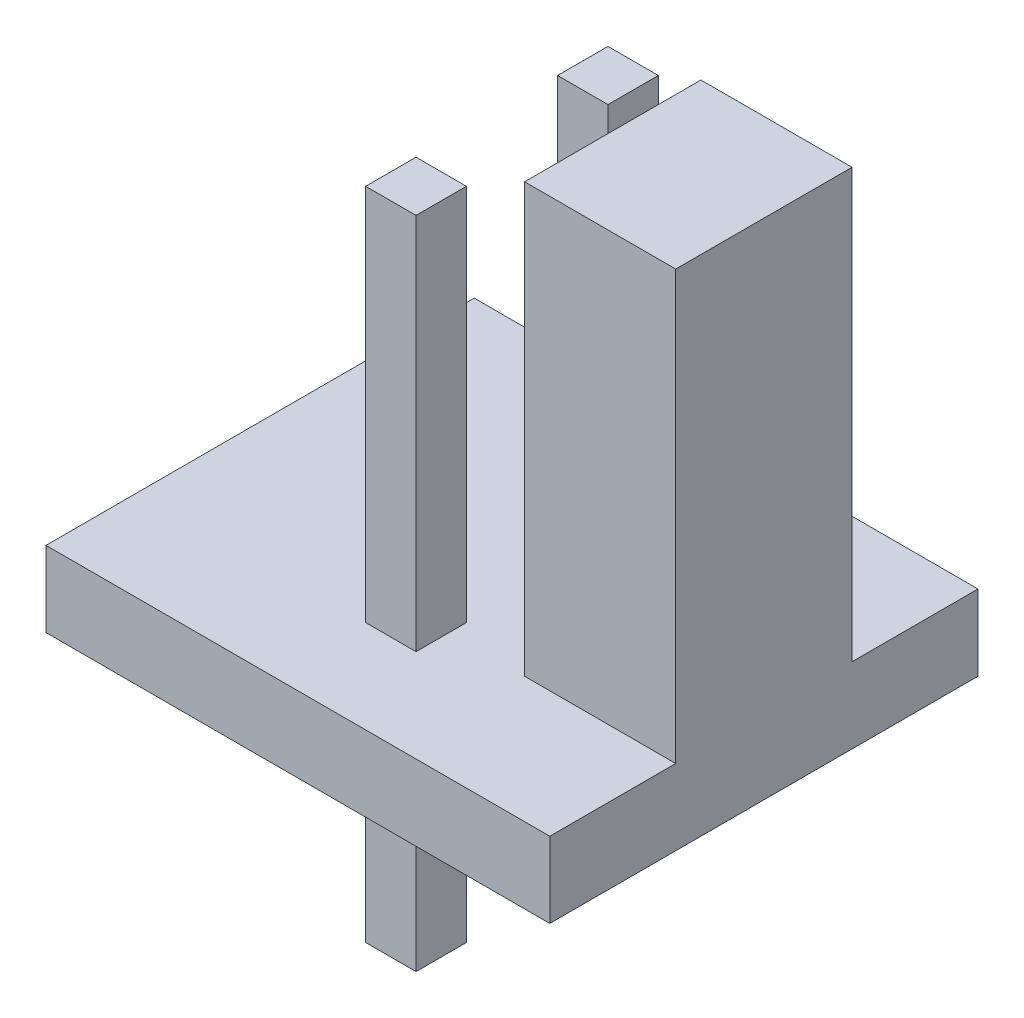
from build123d import *

# Parameters (mm, degrees)
SKETCH_1_W           = 10
SKETCH_1_H           = 8.5
EXTRUDE_1_DEPTH      = 10
CUT_EXTRUDE_1_DEPTH  = 8.5
EXTRUDE_2_DEPTH      = 4
EXTRUDE_2_DEPTH_BACK = 9
SKETCH_3_W           = 1
SKETCH_3_H           = 1


with BuildPart() as part:
    # 草图1 → 拉伸1 (new body)
    with BuildSketch(Plane(origin=(0, 0, 0), x_dir=(1, 0, 0), z_dir=(0, 1, 0))):
        Rectangle(SKETCH_1_W, SKETCH_1_H)
    extrude(amount=EXTRUDE_1_DEPTH)

    # 草图2 → 切除-拉伸1 (cut)
    with BuildSketch(Plane(origin=(0, 10, 0), x_dir=(-1, 0, 0), z_dir=(0, 1, 0))):
        Polygon((-5, 1.75), (-5, 4.25), (5, 4.25), (5, -4.25), (-5, -4.25), (-5, -1.75), (-2, -1.75), (-2, 1.75), align=None)
    extrude(amount=-CUT_EXTRUDE_1_DEPTH, mode=Mode.SUBTRACT)

    # 草图3 → 拉伸2 (add, two sides: drawn at the far end of the back side and taken through both)
    with BuildSketch(Plane.XZ.offset(-EXTRUDE_2_DEPTH_BACK)):
        with Locations((0, 1.905)):
            Rectangle(SKETCH_3_W, SKETCH_3_H)
        with Locations((0, -1.905)):
            Rectangle(SKETCH_3_W, SKETCH_3_H)
    extrude(amount=EXTRUDE_2_DEPTH + EXTRUDE_2_DEPTH_BACK)


solid = part.part
